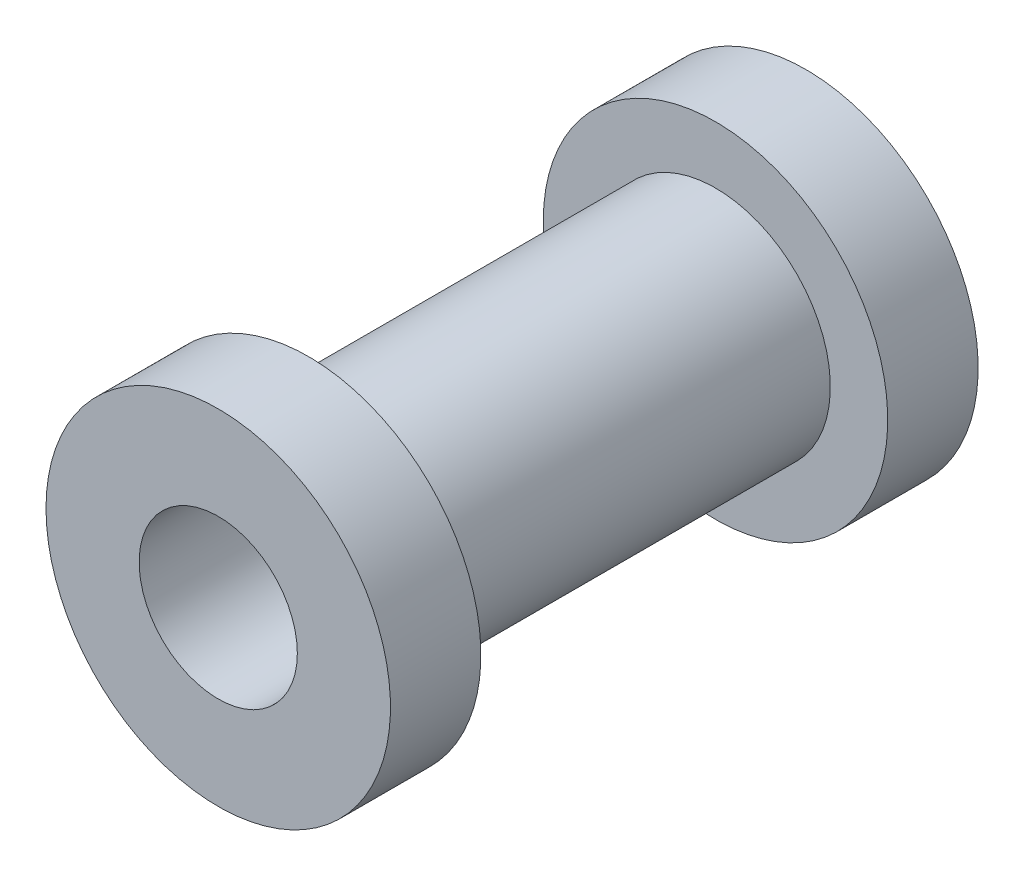
from build123d import *

# Parameters (mm, degrees)
SKETCH1_R           = 25.4
SKETCH1_R_2         = 17.5
BOSS_EXTRUDE1_DEPTH = 65
BOSS_EXTRUDE2_START = -20
SKETCH2_R           = 38.1
SKETCH2_R_2         = 25.4
BOSS_EXTRUDE2_DEPTH = 20


with BuildPart() as part:
    # Sketch1 → Boss-Extrude1 (new, symmetric)
    with BuildSketch(Plane.XY):
        Circle(SKETCH1_R)
        Circle(SKETCH1_R_2, mode=Mode.SUBTRACT)
    extrude(amount=BOSS_EXTRUDE1_DEPTH, both=True)

    # Sketch2 → Boss-Extrude2 (add)
    with BuildSketch(Plane(origin=(0, 0, -65), x_dir=(-1, 0, 0), z_dir=(0, 0, -1)).offset(BOSS_EXTRUDE2_START)):
        Circle(SKETCH2_R)
        Circle(SKETCH2_R_2, mode=Mode.SUBTRACT)
    boss_extrude2 = extrude(amount=BOSS_EXTRUDE2_DEPTH)

    # Mirror1: Boss-Extrude2 across plane
    add(boss_extrude2.mirror(Plane.XY))


solid = part.part
